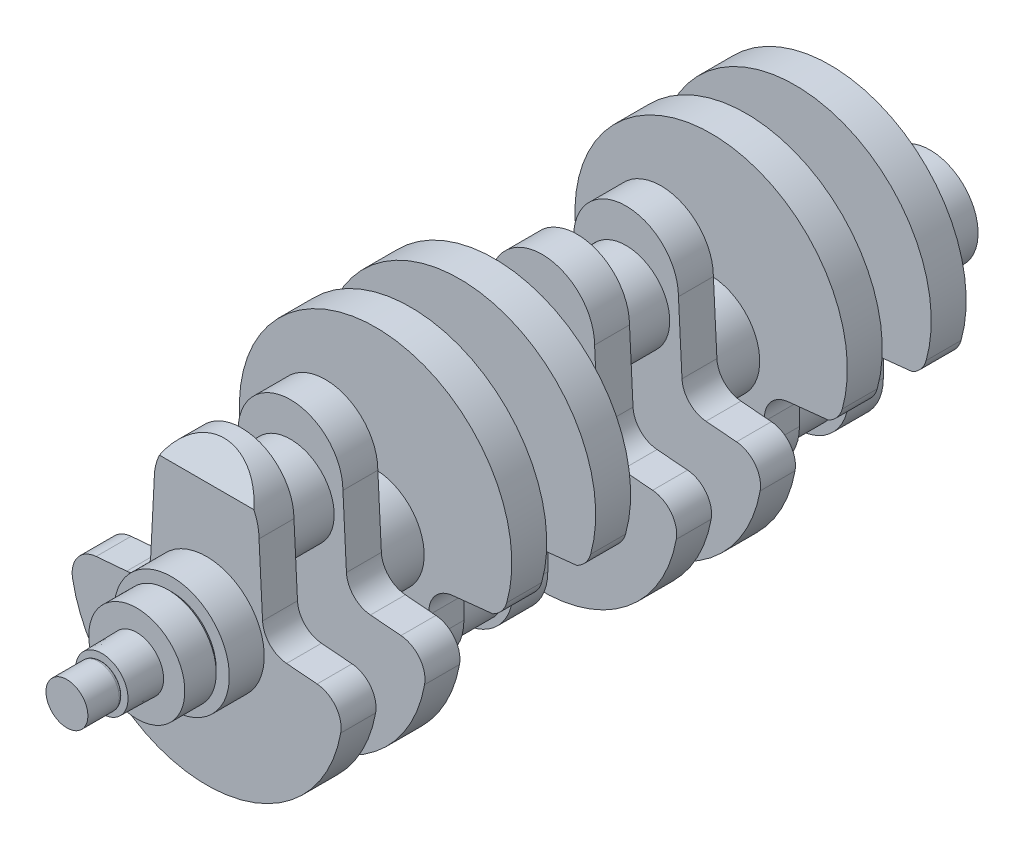
from build123d import *

# Parameters (mm, degrees)
SKETCH1_R               = 12
BOSS_EXTRUDE1_DEPTH     = 20
FILLET1_R               = 2
SKETCH2_R               = 15
BOSS_EXTRUDE2_DEPTH     = 20
BOSS_EXTRUDE2_DRAFT     = -1
SKETCH3_R               = 27.5
BOSS_EXTRUDE3_DEPTH     = 20
CHAMFER1_SIZE           = 2
SKETCH4_R               = 33
BOSS_EXTRUDE4_DEPTH     = 20
BOSS_EXTRUDE5_DEPTH     = 20
CUT_EXTRUDE2_DEPTH      = 81
CUT_EXTRUDE2_DEPTH_BACK = 46
SKETCH7_R               = 25
BOSS_EXTRUDE6_DEPTH     = 28.03
BOSS_EXTRUDE7_DEPTH     = 20
SKETCH9_R               = 28.5
BOSS_EXTRUDE8_DEPTH     = 28.03
BOSS_EXTRUDE9_DEPTH     = 20
SKETCH12_R              = 25
BOSS_EXTRUDE10_DEPTH    = 28.03
BOSS_EXTRUDE11_DEPTH    = 20
SKETCH14_R              = 28.5
BOSS_EXTRUDE12_DEPTH    = 28.03
BOSS_EXTRUDE13_DEPTH    = 20
SKETCH16_R              = 25
BOSS_EXTRUDE14_DEPTH    = 28.03
BOSS_EXTRUDE15_DEPTH    = 20
SKETCH18_R              = 28.5
BOSS_EXTRUDE16_DEPTH    = 28.03
BOSS_EXTRUDE17_DEPTH    = 20
SKETCH20_R              = 25
BOSS_EXTRUDE18_DEPTH    = 28.03
BOSS_EXTRUDE19_DEPTH    = 20
SKETCH22_R              = 33
BOSS_EXTRUDE20_DEPTH    = 28
SKETCH23_R              = 27.5
BOSS_EXTRUDE21_DEPTH    = 30


with BuildPart() as part:
    # Sketch1 → Boss-Extrude1 (new body)
    with BuildSketch(Plane.XY):
        Circle(SKETCH1_R)
    extrude(amount=-BOSS_EXTRUDE1_DEPTH)

    # Fillet1
    fillet1_edges = [part.edges().sort_by_distance(p)[0] for p in [
        (-12, 0, -20),
    ]]
    fillet(fillet1_edges, radius=FILLET1_R)


with BuildPart() as boss_extrude2_tool:
    # Sketch2 → Boss-Extrude2 (with draft: the straight prism first)
    with BuildSketch(Plane(origin=(0, 0, -20), x_dir=(-1, 0, 0), z_dir=(0, 0, -1))):
        Circle(SKETCH2_R)
    extrude(amount=BOSS_EXTRUDE2_DEPTH)
    # Boss-Extrude2: the draft: its side faces are tilted about the plane it starts from
    boss_extrude2_sides = [boss_extrude2_tool.faces().sort_by_distance(p)[0] for p in [
        (15, 0, -30),
    ]]
    draft(boss_extrude2_sides, Plane(origin=(0, 0, -20), x_dir=(-1, 0, 0), z_dir=(0, 0, -1)), BOSS_EXTRUDE2_DRAFT)


with BuildPart() as part_1:
    add(part.part)

    # Boss-Extrude2: add boss_extrude2_tool
    add(boss_extrude2_tool.part)

    # Sketch3 → Boss-Extrude3 (add)
    with BuildSketch(Plane(origin=(0, 0, -40), x_dir=(-1, 0, 0), z_dir=(0, 0, -1))):
        Circle(SKETCH3_R)
    extrude(amount=BOSS_EXTRUDE3_DEPTH)

    # Chamfer1
    chamfer1_edges = [part_1.edges().sort_by_distance(p)[0] for p in [
        (27.5, 0, -60),
    ]]
    chamfer(chamfer1_edges, length=CHAMFER1_SIZE)

    # Sketch4 → Boss-Extrude4 (add)
    with BuildSketch(Plane(origin=(0, 0, -60), x_dir=(-1, 0, 0), z_dir=(0, 0, -1))):
        Circle(SKETCH4_R)
    extrude(amount=BOSS_EXTRUDE4_DEPTH)

    # Sketch5 → Boss-Extrude5 (add)
    with BuildSketch(Plane(origin=(0, 0, -80), x_dir=(-1, 0, 0), z_dir=(0, 0, -1))):
        with BuildLine():
            Line((-30, 56.775824047), (-32.01935713, 17.065573544))
            ThreePointArc((-32.01935713, 17.065573544), (-36.223643753, 7.393287744), (-45.755240699, 2.87911027))
            Line((-45.755240699, 2.87911027), (-63.244759301, 1.422737675))
            ThreePointArc((-63.244759301, 1.422737675), (-73.898888206, -4.392264416), (-76.761904762, -16.187511266))
            ThreePointArc((-76.761904762, -16.187511266), (0, -80.345185691), (76.761904762, -16.187511266))
            ThreePointArc((76.761904762, -16.187511266), (73.898888206, -4.392264416), (63.244759301, 1.422737675))
            Line((63.244759301, 1.422737675), (45.755240699, 2.87911027))
            ThreePointArc((45.755240699, 2.87911027), (36.223643753, 7.393287744), (32.01935713, 17.065573544))
            Line((32.01935713, 17.065573544), (30, 56.775824047))
            ThreePointArc((30, 56.775824047), (0, 86.775824047), (-30, 56.775824047))
        make_face()
    extrude(amount=BOSS_EXTRUDE5_DEPTH)

    # Sketch6 → Cut-Extrude2 (cut, two sides: drawn at the far end of the back side and taken through both)
    with BuildSketch(Plane(origin=(0, 0, 0), x_dir=(0, 0, -1), z_dir=(1, 0, 0)).offset(-CUT_EXTRUDE2_DEPTH_BACK)):
        Polygon((90, 86.775824047), (80, 69.775824047), (80, 86.775824047), align=None)
    extrude(amount=CUT_EXTRUDE2_DEPTH + CUT_EXTRUDE2_DEPTH_BACK, mode=Mode.SUBTRACT)

    # Sketch7 → Boss-Extrude6 (add)
    with BuildSketch(Plane(origin=(0, 0, -100), x_dir=(-1, 0, 0), z_dir=(0, 0, -1))):
        with Locations((0, 42.18)):
            Circle(SKETCH7_R)
    extrude(amount=BOSS_EXTRUDE6_DEPTH)


with BuildPart() as body_2:
    # Sketch8 → Boss-Extrude7 (new body)
    with BuildSketch(Plane(origin=(0, 0, -128.03), x_dir=(-1, 0, 0), z_dir=(0, 0, -1))):
        with BuildLine():
            Line((-30, 56.775824047), (-32.01935713, 17.065573544))
            ThreePointArc((-32.01935713, 17.065573544), (-36.223643753, 7.393287744), (-45.755240699, 2.87911027))
            Line((-45.755240699, 2.87911027), (-63.244759301, 1.422737675))
            ThreePointArc((-63.244759301, 1.422737675), (-73.898888206, -4.392264416), (-76.761904762, -16.187511266))
            ThreePointArc((-76.761904762, -16.187511266), (0, -80.345185691), (76.761904762, -16.187511266))
            ThreePointArc((76.761904762, -16.187511266), (73.898888206, -4.392264416), (63.244759301, 1.422737675))
            Line((63.244759301, 1.422737675), (45.755240699, 2.87911027))
            ThreePointArc((45.755240699, 2.87911027), (36.223643753, 7.393287744), (32.01935713, 17.065573544))
            Line((32.01935713, 17.065573544), (30, 56.775824047))
            ThreePointArc((30, 56.775824047), (0, 86.775824047), (-30, 56.775824047))
        make_face()
    extrude(amount=BOSS_EXTRUDE7_DEPTH)

    # Sketch9 → Boss-Extrude8 (add)
    with BuildSketch(Plane(origin=(0, 0, -148.03), x_dir=(-1, 0, 0), z_dir=(0, 0, -1))):
        Circle(SKETCH9_R)
    extrude(amount=BOSS_EXTRUDE8_DEPTH)

    # Sketch11 → Boss-Extrude9 (add)
    with BuildSketch(Plane(origin=(0, 0, -176.06), x_dir=(-1, 0, 0), z_dir=(0, 0, -1))):
        with BuildLine():
            Line((-31.245810287, -28.395403668), (-31.245810287, -40.994880292))
            ThreePointArc((-31.245810287, -40.994880292), (-1.519355146, -70.993633153), (28.74920126, -41.541947267))
            Line((28.74920126, -41.541947267), (28.978959845, -28.944565706))
            ThreePointArc((28.978959845, -28.944565706), (32.462156631, -18.034921566), (42.62869008, -12.762863833))
            Line((42.62869008, -12.762863833), (65.876665322, -10.741857315))
            ThreePointArc((65.876665322, -10.741857315), (70.954693066, -6.956345135), (74.017622446, -1.412435698))
            ThreePointArc((74.017622446, -1.412435698), (0.031101592, 99.039789098), (-75.774919811, -0.046546255))
            ThreePointArc((-75.774919811, -0.046546255), (-72.813596065, -5.645388091), (-67.805443661, -9.522871519))
            Line((-67.805443661, -9.522871519), (-44.598188331, -11.967481963))
            ThreePointArc((-44.598188331, -11.967481963), (-34.529484347, -17.424055539), (-31.245810287, -28.395403668))
        make_face()
    extrude(amount=BOSS_EXTRUDE9_DEPTH)

    # Sketch12 → Boss-Extrude10 (add)
    with BuildSketch(Plane(origin=(0, 0, -196.06), x_dir=(-1, 0, 0), z_dir=(0, 0, -1))):
        with Locations(Location((-1.933791065, -42, 0), (0, 0, 180))):
            Circle(SKETCH12_R)
    extrude(amount=BOSS_EXTRUDE10_DEPTH)

    # Sketch13 → Boss-Extrude11 (add)
    with BuildSketch(Plane(origin=(0, 0, -224.09), x_dir=(-1, 0, 0), z_dir=(0, 0, -1))):
        with BuildLine():
            Line((-31.245810287, -28.395403668), (-31.245810287, -40.994880292))
            ThreePointArc((-31.245810287, -40.994880292), (-1.519355146, -70.993633153), (28.74920126, -41.541947267))
            Line((28.74920126, -41.541947267), (28.978959845, -28.944565706))
            ThreePointArc((28.978959845, -28.944565706), (32.462156631, -18.034921566), (42.62869008, -12.762863833))
            Line((42.62869008, -12.762863833), (65.876665322, -10.741857315))
            ThreePointArc((65.876665322, -10.741857315), (70.954693066, -6.956345135), (74.017622446, -1.412435698))
            ThreePointArc((74.017622446, -1.412435698), (0.031101592, 99.039789098), (-75.774919811, -0.046546255))
            ThreePointArc((-75.774919811, -0.046546255), (-72.813596065, -5.645388091), (-67.805443661, -9.522871519))
            Line((-67.805443661, -9.522871519), (-44.598188331, -11.967481963))
            ThreePointArc((-44.598188331, -11.967481963), (-34.529484347, -17.424055539), (-31.245810287, -28.395403668))
        make_face()
    extrude(amount=BOSS_EXTRUDE11_DEPTH)

    # Sketch14 → Boss-Extrude12 (add)
    with BuildSketch(Plane(origin=(0, 0, -244.09), x_dir=(-1, 0, 0), z_dir=(0, 0, -1))):
        Circle(SKETCH14_R)
    extrude(amount=BOSS_EXTRUDE12_DEPTH)

    # Sketch15 → Boss-Extrude13 (add)
    with BuildSketch(Plane(origin=(0, 0, -272.12), x_dir=(-1, 0, 0), z_dir=(0, 0, -1))):
        with BuildLine():
            Line((63.244759301, 1.422737675), (45.755240699, 2.87911027))
            ThreePointArc((45.755240699, 2.87911027), (36.223643753, 7.393287744), (32.01935713, 17.065573544))
            Line((32.01935713, 17.065573544), (30, 56.775824047))
            ThreePointArc((30, 56.775824047), (0, 86.775824047), (-30, 56.775824047))
            Line((-30, 56.775824047), (-32.01935713, 17.065573544))
            ThreePointArc((-32.01935713, 17.065573544), (-36.223643753, 7.393287744), (-45.755240699, 2.87911027))
            Line((-45.755240699, 2.87911027), (-63.244759301, 1.422737675))
            ThreePointArc((-63.244759301, 1.422737675), (-73.898888206, -4.392264416), (-76.761904762, -16.187511266))
            ThreePointArc((-76.761904762, -16.187511266), (0, -80.345185691), (76.761904762, -16.187511266))
            ThreePointArc((76.761904762, -16.187511266), (73.898888206, -4.392264416), (63.244759301, 1.422737675))
        make_face()
    extrude(amount=BOSS_EXTRUDE13_DEPTH)

    # Sketch16 → Boss-Extrude14 (add)
    with BuildSketch(Plane(origin=(0, 0, -292.12), x_dir=(-1, 0, 0), z_dir=(0, 0, -1))):
        with Locations((0, 42.18)):
            Circle(SKETCH16_R)
    extrude(amount=BOSS_EXTRUDE14_DEPTH)

    # Sketch17 → Boss-Extrude15 (add)
    with BuildSketch(Plane(origin=(0, 0, -320.15), x_dir=(-1, 0, 0), z_dir=(0, 0, -1))):
        with BuildLine():
            Line((63.244759301, 1.422737675), (45.755240699, 2.87911027))
            ThreePointArc((45.755240699, 2.87911027), (36.223643753, 7.393287744), (32.01935713, 17.065573544))
            Line((32.01935713, 17.065573544), (30, 56.775824047))
            ThreePointArc((30, 56.775824047), (0, 86.775824047), (-30, 56.775824047))
            Line((-30, 56.775824047), (-32.01935713, 17.065573544))
            ThreePointArc((-32.01935713, 17.065573544), (-36.223643753, 7.393287744), (-45.755240699, 2.87911027))
            Line((-45.755240699, 2.87911027), (-63.244759301, 1.422737675))
            ThreePointArc((-63.244759301, 1.422737675), (-73.898888206, -4.392264416), (-76.761904762, -16.187511266))
            ThreePointArc((-76.761904762, -16.187511266), (0, -80.345185691), (76.761904762, -16.187511266))
            ThreePointArc((76.761904762, -16.187511266), (73.898888206, -4.392264416), (63.244759301, 1.422737675))
        make_face()
    extrude(amount=BOSS_EXTRUDE15_DEPTH)

    # Sketch18 → Boss-Extrude16 (add)
    with BuildSketch(Plane(origin=(0, 0, -340.15), x_dir=(-1, 0, 0), z_dir=(0, 0, -1))):
        Circle(SKETCH18_R)
    extrude(amount=BOSS_EXTRUDE16_DEPTH)

    # Sketch19 → Boss-Extrude17 (add)
    with BuildSketch(Plane(origin=(0, 0, -368.18), x_dir=(-1, 0, 0), z_dir=(0, 0, -1))):
        with BuildLine():
            Line((-31.245810287, -28.395403668), (-31.245810287, -40.994880292))
            ThreePointArc((-31.245810287, -40.994880292), (-1.519355146, -70.993633153), (28.74920126, -41.541947267))
            Line((28.74920126, -41.541947267), (28.978959845, -28.944565706))
            ThreePointArc((28.978959845, -28.944565706), (32.462156631, -18.034921566), (42.62869008, -12.762863833))
            Line((42.62869008, -12.762863833), (65.876665322, -10.741857315))
            ThreePointArc((65.876665322, -10.741857315), (70.954693066, -6.956345135), (74.017622446, -1.412435698))
            ThreePointArc((74.017622446, -1.412435698), (0.031101592, 99.039789098), (-75.774919811, -0.046546255))
            ThreePointArc((-75.774919811, -0.046546255), (-72.813596065, -5.645388091), (-67.805443661, -9.522871519))
            Line((-67.805443661, -9.522871519), (-44.598188331, -11.967481963))
            ThreePointArc((-44.598188331, -11.967481963), (-34.529484347, -17.424055539), (-31.245810287, -28.395403668))
        make_face()
    extrude(amount=BOSS_EXTRUDE17_DEPTH)

    # Sketch20 → Boss-Extrude18 (add)
    with BuildSketch(Plane(origin=(0, 0, -388.18), x_dir=(-1, 0, 0), z_dir=(0, 0, -1))):
        with Locations((0, -42)):
            Circle(SKETCH20_R)
    extrude(amount=BOSS_EXTRUDE18_DEPTH)

    # Sketch21 → Boss-Extrude19 (add)
    with BuildSketch(Plane(origin=(0, 0, -416.21), x_dir=(-1, 0, 0), z_dir=(0, 0, -1))):
        with BuildLine():
            Line((-31.245810287, -28.395403668), (-31.245810287, -40.994880292))
            ThreePointArc((-31.245810287, -40.994880292), (-1.519355146, -70.993633153), (28.74920126, -41.541947267))
            Line((28.74920126, -41.541947267), (28.978959845, -28.944565706))
            ThreePointArc((28.978959845, -28.944565706), (32.462156631, -18.034921566), (42.62869008, -12.762863833))
            Line((42.62869008, -12.762863833), (65.876665322, -10.741857315))
            ThreePointArc((65.876665322, -10.741857315), (70.954693066, -6.956345135), (74.017622446, -1.412435698))
            ThreePointArc((74.017622446, -1.412435698), (0.031101592, 99.039789098), (-75.774919811, -0.046546255))
            ThreePointArc((-75.774919811, -0.046546255), (-72.813596065, -5.645388091), (-67.805443661, -9.522871519))
            Line((-67.805443661, -9.522871519), (-44.598188331, -11.967481963))
            ThreePointArc((-44.598188331, -11.967481963), (-34.529484347, -17.424055539), (-31.245810287, -28.395403668))
        make_face()
    extrude(amount=BOSS_EXTRUDE19_DEPTH)

    # Sketch22 → Boss-Extrude20 (add)
    with BuildSketch(Plane(origin=(0, 0, -436.21), x_dir=(-1, 0, 0), z_dir=(0, 0, -1))):
        Circle(SKETCH22_R)
    extrude(amount=BOSS_EXTRUDE20_DEPTH)

    # Sketch23 → Boss-Extrude21 (add)
    with BuildSketch(Plane(origin=(0, 0, -464.21), x_dir=(-1, 0, 0), z_dir=(0, 0, -1))):
        Circle(SKETCH23_R)
    extrude(amount=BOSS_EXTRUDE21_DEPTH)


solid = Compound([part_1.part, body_2.part])
